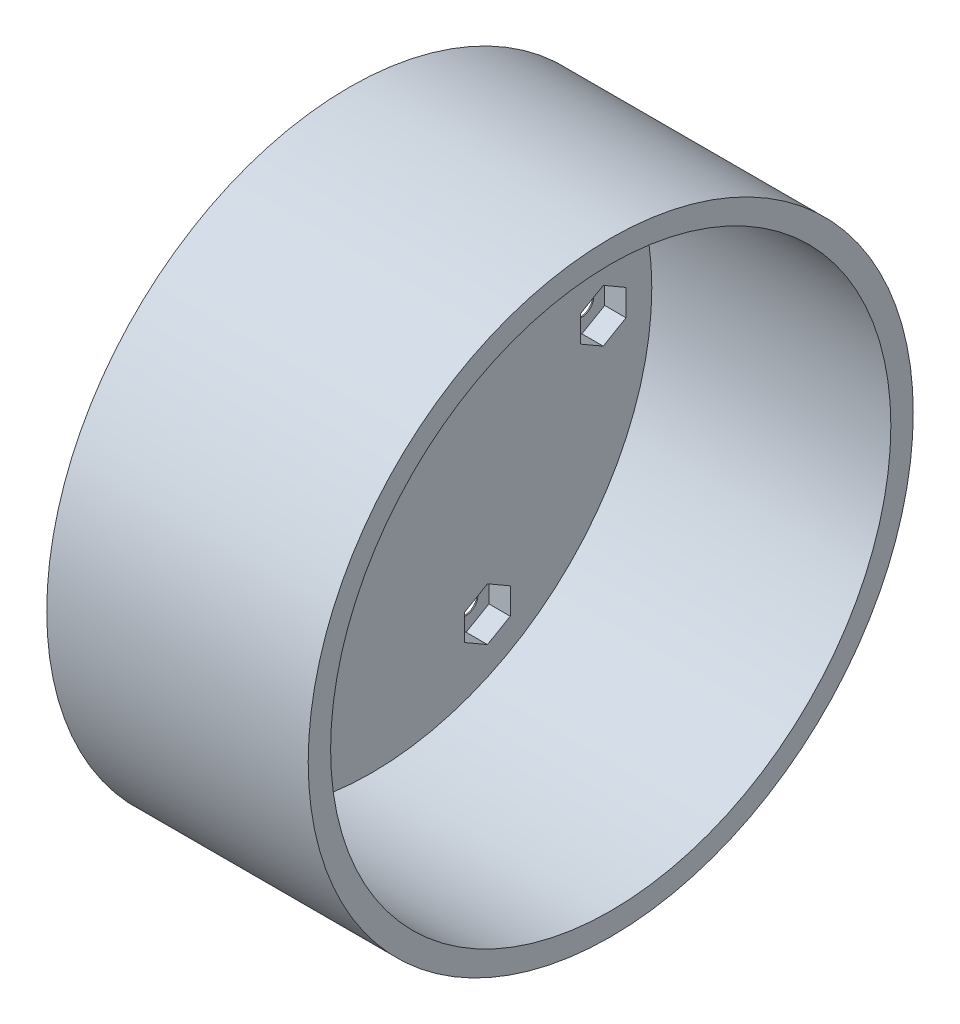
from build123d import *

# Parameters (mm, degrees)
CUT_EXTRUDE1_REACH = 67.609
SKETCH2_R          = 1.5875
CUT_EXTRUDE2_DEPTH = 2.8575
CIRPATTERN1_COUNT  = 6
CUT_EXTRUDE3_REACH = 67.609
SKETCH4_R          = 3


with BuildPart() as part:
    # Sketch1 → Revolve1 (revolve)
    with BuildSketch(Plane.XY, mode=Mode.PRIVATE) as revolve1_sk:
        Polygon((0, 0), (0, 40.5), (35, 40.5), (35, 37.5), (3, 37.5), (3, 0), align=None)
    revolve(revolve1_sk.sketch.rotate(Axis((0, 0, 0), (1, 0, 0)), 90), axis=Axis((0, 0, 0), (1, 0, 0)))

    # Sketch2 → Cut-Extrude1 (cut, up to next)
    with BuildSketch(Plane(origin=(3, 0, 0), x_dir=(0, 0, -1), z_dir=(1, 0, 0)), mode=Mode.PRIVATE) as cut_extrude1_sk1:
        with Locations((-31, 0)):
            Circle(SKETCH2_R)
    cut_extrude1_tool1 = extrude(cut_extrude1_sk1.sketch, amount=-CUT_EXTRUDE1_REACH, mode=Mode.PRIVATE) & part.part
    # Sketch2 → Cut-Extrude1 (cut, up to next)
    with BuildSketch(Plane(origin=(3, 0, 0), x_dir=(0, 0, -1), z_dir=(1, 0, 0)), mode=Mode.PRIVATE) as cut_extrude1_sk2:
        with Locations((-15.5, 26.846787517)):
            Circle(SKETCH2_R)
    cut_extrude1_tool2 = extrude(cut_extrude1_sk2.sketch, amount=-CUT_EXTRUDE1_REACH, mode=Mode.PRIVATE) & part.part
    # Sketch2 → Cut-Extrude1 (cut, up to next)
    with BuildSketch(Plane(origin=(3, 0, 0), x_dir=(0, 0, -1), z_dir=(1, 0, 0)), mode=Mode.PRIVATE) as cut_extrude1_sk3:
        with Locations((15.5, 26.846787517)):
            Circle(SKETCH2_R)
    cut_extrude1_tool3 = extrude(cut_extrude1_sk3.sketch, amount=-CUT_EXTRUDE1_REACH, mode=Mode.PRIVATE) & part.part
    # Sketch2 → Cut-Extrude1 (cut, up to next)
    with BuildSketch(Plane(origin=(3, 0, 0), x_dir=(0, 0, -1), z_dir=(1, 0, 0)), mode=Mode.PRIVATE) as cut_extrude1_sk4:
        with Locations((31, 0)):
            Circle(SKETCH2_R)
    cut_extrude1_tool4 = extrude(cut_extrude1_sk4.sketch, amount=-CUT_EXTRUDE1_REACH, mode=Mode.PRIVATE) & part.part
    # Sketch2 → Cut-Extrude1 (cut, up to next)
    with BuildSketch(Plane(origin=(3, 0, 0), x_dir=(0, 0, -1), z_dir=(1, 0, 0)), mode=Mode.PRIVATE) as cut_extrude1_sk5:
        with Locations((15.5, -26.846787517)):
            Circle(SKETCH2_R)
    cut_extrude1_tool5 = extrude(cut_extrude1_sk5.sketch, amount=-CUT_EXTRUDE1_REACH, mode=Mode.PRIVATE) & part.part
    # Sketch2 → Cut-Extrude1 (cut, up to next)
    with BuildSketch(Plane(origin=(3, 0, 0), x_dir=(0, 0, -1), z_dir=(1, 0, 0)), mode=Mode.PRIVATE) as cut_extrude1_sk6:
        with Locations((-15.5, -26.846787517)):
            Circle(SKETCH2_R)
    cut_extrude1_tool6 = extrude(cut_extrude1_sk6.sketch, amount=-CUT_EXTRUDE1_REACH, mode=Mode.PRIVATE) & part.part
    add(cut_extrude1_tool1.solids().sort_by_distance((3, 0, 31))[0], mode=Mode.SUBTRACT)
    add(cut_extrude1_tool2.solids().sort_by_distance((3, 26.846788, 15.5))[0], mode=Mode.SUBTRACT)
    add(cut_extrude1_tool3.solids().sort_by_distance((3, 26.846788, -15.5))[0], mode=Mode.SUBTRACT)
    add(cut_extrude1_tool4.solids().sort_by_distance((3, 0, -31))[0], mode=Mode.SUBTRACT)
    add(cut_extrude1_tool5.solids().sort_by_distance((3, -26.846788, -15.5))[0], mode=Mode.SUBTRACT)
    add(cut_extrude1_tool6.solids().sort_by_distance((3, -26.846788, 15.5))[0], mode=Mode.SUBTRACT)

    # Sketch3 → Cut-Extrude2 (cut)
    with BuildSketch(Plane(origin=(3, 0, 0), x_dir=(0, 0, -1), z_dir=(1, 0, 0))):
        Polygon((18.55, 25.085869196), (18.55, 28.607705838), (15.5, 30.368624159), (12.45, 28.607705838), (12.45, 25.085869196), (15.5, 23.324950875), align=None)
    cut_extrude2 = extrude(amount=-CUT_EXTRUDE2_DEPTH, mode=Mode.SUBTRACT)

    # CirPattern1: Cut-Extrude2 ×6 about axis
    cirpattern1_axis = Axis((0, 0, 0), (1, 0, 0))
    for i in range(1, CIRPATTERN1_COUNT):
        add(cut_extrude2.rotate(cirpattern1_axis, i * 360 / CIRPATTERN1_COUNT), mode=Mode.SUBTRACT)

    # Sketch4 → Cut-Extrude3 (cut, up to next)
    with BuildSketch(Plane(origin=(3, 0, 0), x_dir=(0, 0, -1), z_dir=(1, 0, 0)), mode=Mode.PRIVATE) as cut_extrude3_sk1:
        Circle(SKETCH4_R)
    cut_extrude3_tool1 = extrude(cut_extrude3_sk1.sketch, amount=-CUT_EXTRUDE3_REACH, mode=Mode.PRIVATE) & part.part
    add(cut_extrude3_tool1.solids().sort_by_distance((3, 0, 0))[0], mode=Mode.SUBTRACT)


solid = part.part
